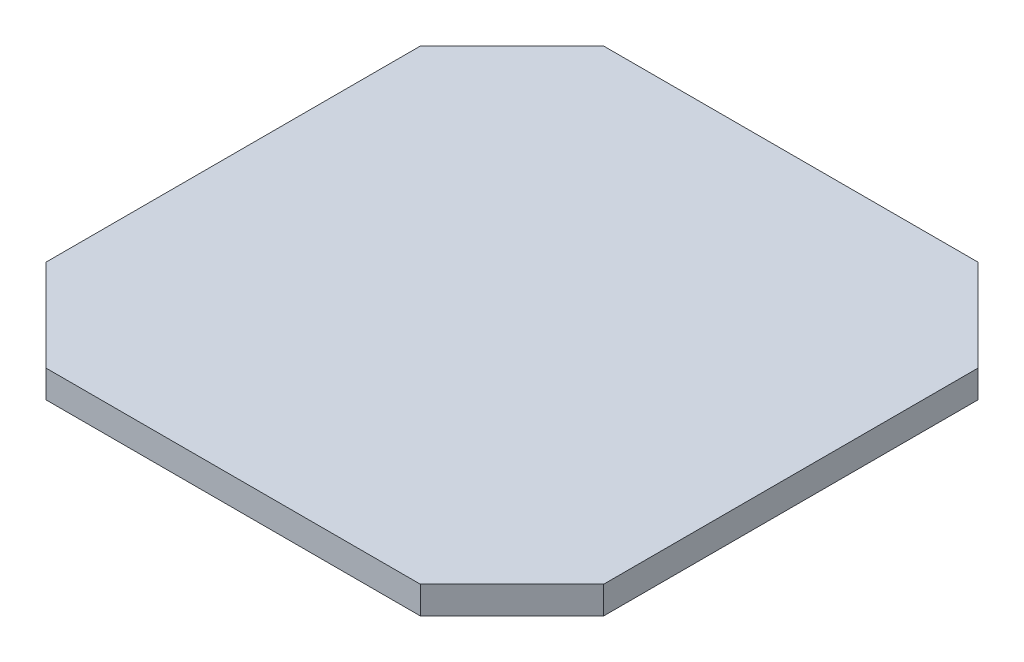
from build123d import *

# Parameters (mm, degrees)
SKETCH2_W           = 6.08
SKETCH2_H           = 6.08
BOSS_EXTRUDE1_DEPTH = 0.3
CHAMFER1_SIZE       = 1


with BuildPart() as part:
    # Sketch2 → Boss-Extrude1 (new body)
    with BuildSketch(Plane(origin=(0, 0, 0), x_dir=(1, 0, 0), z_dir=(0, 1, 0))):
        with Locations((3.04, 3.04)):
            Rectangle(SKETCH2_W, SKETCH2_H)
    extrude(amount=BOSS_EXTRUDE1_DEPTH)

    # Chamfer1
    chamfer1_edges = [part.edges().sort_by_distance(p)[0] for p in [
        (0, 0.15, -6.08),
        (6.08, 0.15, -6.08),
        (6.08, 0.15, 0),
        (0, 0.15, 0),
    ]]
    chamfer(chamfer1_edges, length=CHAMFER1_SIZE)


solid = part.part
